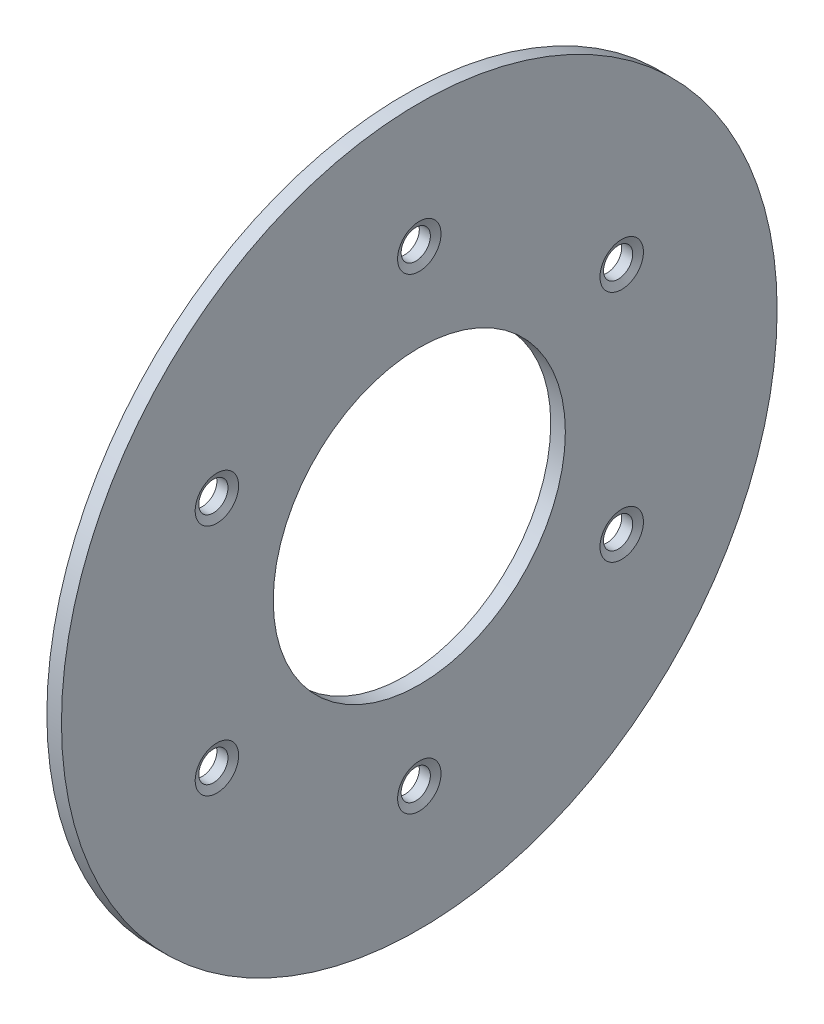
from build123d import *

# Parameters (mm, degrees)
SKETCH1_R           = 49
SKETCH1_R_2         = 20
BOSS_EXTRUDE1_DEPTH = 2
SKETCH1_3_R         = 2
CUT_EXTRUDE2_DEPTH  = 0.5
SKETCH1_4_R         = 2
CUT_EXTRUDE3_DEPTH  = 70.32532005
CIRPATTERN1_COUNT   = 6
CIRPATTERN2_COUNT   = 6


with BuildPart() as part:
    # Sketch1 → Boss-Extrude1 (new body)
    with BuildSketch(Plane.YZ):
        Circle(SKETCH1_R)
        Circle(SKETCH1_R_2, mode=Mode.SUBTRACT)
    extrude(amount=BOSS_EXTRUDE1_DEPTH)

    # Sketch1<3> → Cut-Extrude2 (cut)
    with BuildSketch(Plane.YZ):
        with Locations((32, 0)):
            Circle(SKETCH1_3_R)
    cut_extrude2 = extrude(amount=CUT_EXTRUDE2_DEPTH, mode=Mode.SUBTRACT)

    # Sketch1<4> → Cut-Extrude3 (cut, through all)
    with BuildSketch(Plane.YZ):
        with Locations((32, 0)):
            Circle(SKETCH1_4_R)
    cut_extrude3 = extrude(amount=CUT_EXTRUDE3_DEPTH, mode=Mode.SUBTRACT)

    # CirPattern1: Cut-Extrude2, Cut-Extrude3 ×6 about axis
    cirpattern1_axis = Axis((0, 0, 0), (1, 0, 0))
    add([cut_extrude2.rotate(cirpattern1_axis, i * 360 / CIRPATTERN1_COUNT) for i in range(1, CIRPATTERN1_COUNT)], mode=Mode.SUBTRACT)
    add([cut_extrude3.rotate(cirpattern1_axis, i * 360 / CIRPATTERN1_COUNT) for i in range(1, CIRPATTERN1_COUNT)], mode=Mode.SUBTRACT)

    # Sketch3 → Cut-Revolve1 (revolve, cut)
    with BuildSketch(Plane(origin=(0, 16, 0), x_dir=(-1, 0, 0), z_dir=(0, 1, 0))):
        Polygon((-2.49931716, 31.685808566), (-2.49931716, 27.712812921), (-1.5, 27.712812921), (-1.5, 29.685860989), align=None)
    cut_revolve1 = revolve(axis=Axis((15.134577625, 16, 27.712812921), (-1, 0, 0)), mode=Mode.SUBTRACT)

    # CirPattern2: Cut-Revolve1 ×6 about axis
    cirpattern2_axis = Axis((2, 0, 0), (1, 0, 0))
    for i in range(1, CIRPATTERN2_COUNT):
        add(cut_revolve1.rotate(cirpattern2_axis, i * 360 / CIRPATTERN2_COUNT), mode=Mode.SUBTRACT)


solid = part.part
